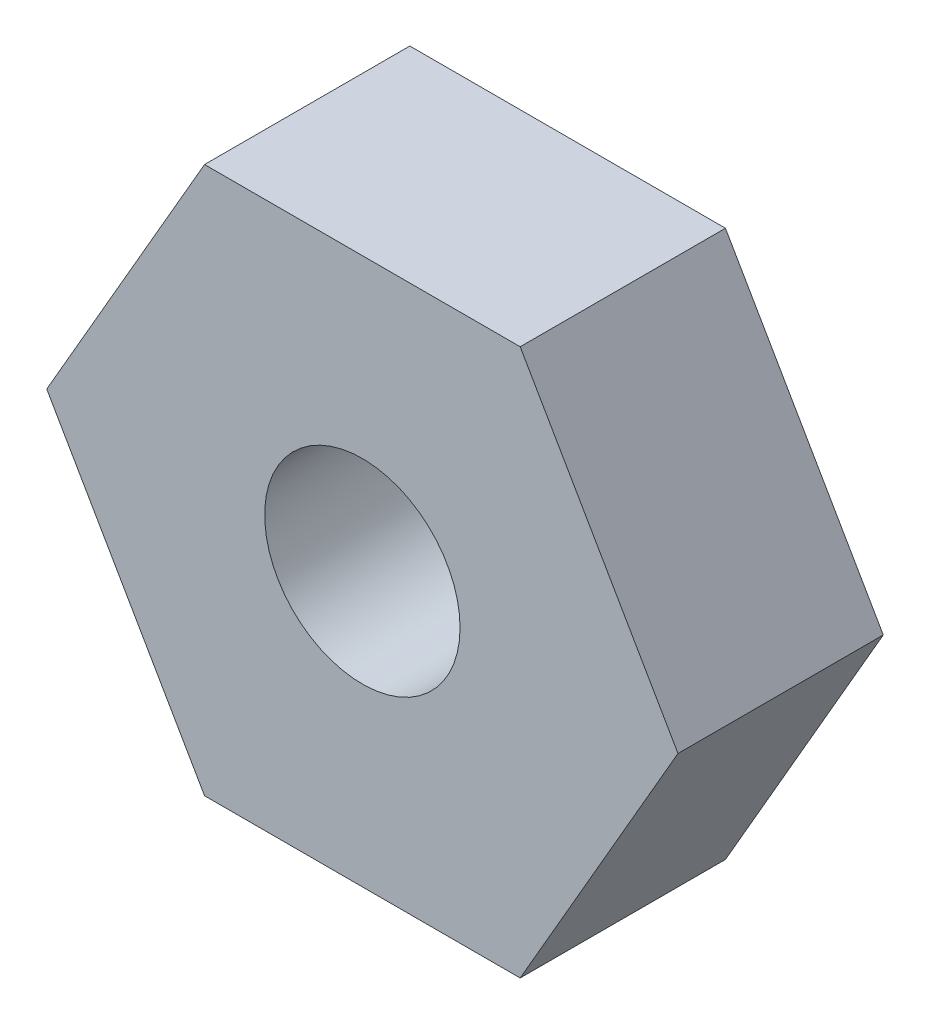
from build123d import *

# Parameters (mm, degrees)
BOSS_EXTRUDE1_DEPTH = 2.3749
SKETCH2_R           = 1.1303
CUT_EXTRUDE1_DEPTH  = 2.3749


with BuildPart() as part:
    # Sketch1 → Boss-Extrude1 (new body)
    with BuildSketch(Plane.XY):
        Polygon((3.651509513, 0), (1.825754756, 3.1623), (-1.825754756, 3.1623), (-3.651509513, 0), (-1.825754756, -3.1623), (1.825754756, -3.1623), align=None)
    extrude(amount=BOSS_EXTRUDE1_DEPTH)

    # Sketch2 → Cut-Extrude1 (cut)
    with BuildSketch(Plane.XY.offset(2.3749)):
        Circle(SKETCH2_R)
    extrude(amount=-CUT_EXTRUDE1_DEPTH, mode=Mode.SUBTRACT)


solid = part.part
